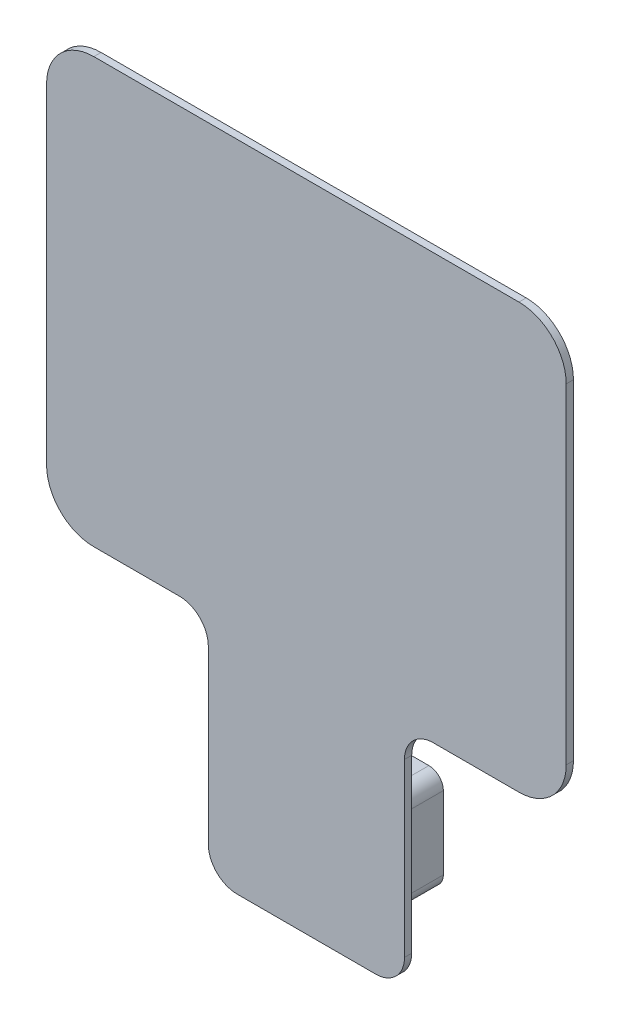
from build123d import *

# Parameters (mm, degrees)
BOSS_EXTRUDE1_DEPTH = 5
SKETCH2_R           = 9
CUT_EXTRUDE1_DEPTH  = 75
BOSS_EXTRUDE2_DEPTH = 15
SKETCH4_R           = 18.116170111
SKETCH4_R_2         = 11.683917043
CUT_EXTRUDE2_DEPTH  = 15
CUT_EXTRUDE2_TAPER  = 45
SKETCH5_W           = 100.933414707
SKETCH5_H           = 70.54527083
BOSS_EXTRUDE3_DEPTH = 40
FILLET1_R           = 10
SKETCH6_W           = 80.933414707
SKETCH6_H           = 50.54527083
CUT_EXTRUDE3_DEPTH  = 7
SKETCH7_R           = 6.405339055
CUT_EXTRUDE4_DEPTH  = 22


with BuildPart() as part:
    # Sketch1 → Boss-Extrude1 (new body)
    with BuildSketch(Plane.XY):
        with BuildLine():
            Line((-147.184574627, 293.941978101), (147.184574627, 293.941978101))
            ThreePointArc((147.184574627, 293.941978101), (170.33130349, 284.354289081), (179.91899251, 261.207560218))
            Line((179.91899251, 261.207560218), (179.91899251, 32.734417883))
            ThreePointArc((179.91899251, 32.734417883), (170.33130349, 9.58768902), (147.184574627, 0))
            Line((147.184574627, 0), (87.922065379, 0))
            ThreePointArc((87.922065379, 0), (73.779929755, -5.857864376), (67.922065379, -20))
            Line((67.922065379, -20), (67.922065379, -138.690071177))
            ThreePointArc((67.922065379, -138.690071177), (62.064201003, -152.832206801), (47.922065379, -158.690071177))
            Line((47.922065379, -158.690071177), (-47.922065379, -158.690071177))
            ThreePointArc((-47.922065379, -158.690071177), (-62.064201003, -152.832206801), (-67.922065379, -138.690071177))
            Line((-67.922065379, -138.690071177), (-67.922065379, -20))
            ThreePointArc((-67.922065379, -20), (-73.779929755, -5.857864376), (-87.922065379, 0))
            Line((-87.922065379, 0), (-147.184574627, 0))
            ThreePointArc((-147.184574627, 0), (-170.33130349, 9.58768902), (-179.91899251, 32.734417883))
            Line((-179.91899251, 32.734417883), (-179.91899251, 261.207560218))
            ThreePointArc((-179.91899251, 261.207560218), (-170.33130349, 284.354289081), (-147.184574627, 293.941978101))
        make_face()
    extrude(amount=BOSS_EXTRUDE1_DEPTH)

    # Sketch2 → Cut-Extrude1 (cut)
    with BuildSketch(Plane.XY.offset(5)):
        with Locations((-147.184574627, 261.207560218)):
            Circle(SKETCH2_R)
        with Locations((147.184574627, 261.207560218)):
            Circle(SKETCH2_R)
        with Locations((147.184574627, 32.734417883)):
            Circle(SKETCH2_R)
        with Locations((-147.184574627, 32.734417883)):
            Circle(SKETCH2_R)
    extrude(amount=-CUT_EXTRUDE1_DEPTH, mode=Mode.SUBTRACT)

    # Sketch3 → Boss-Extrude2 (add)
    with BuildSketch(Plane.XY.offset(5)):
        Polygon((139.58276715, 272.953720991), (133.211197263, 260.497282214), (140.81300474, 248.751121442), (154.786382105, 249.461399446), (161.157951992, 261.917838222), (153.556144514, 273.663998995), align=None)
        Polygon((-140.81300474, 273.663998995), (-154.786382105, 272.953720991), (-161.157951992, 260.497282214), (-153.556144514, 248.751121442), (-139.58276715, 249.461399446), (-133.211197263, 261.917838222), align=None)
        Polygon((139.58276715, 44.480578655), (133.211197263, 32.024139879), (140.81300474, 20.277979107), (154.786382105, 20.988257111), (161.157951992, 33.444695887), (153.556144514, 45.190856659), align=None)
        Polygon((-154.786382105, 44.480578655), (-161.157951992, 32.024139879), (-153.556144514, 20.277979107), (-139.58276715, 20.988257111), (-133.211197263, 33.444695887), (-140.81300474, 45.190856659), align=None)
    extrude(amount=-BOSS_EXTRUDE2_DEPTH)

    # Sketch4 → Cut-Extrude2 (cut)
    # profile 1 of 4: a face of its own
    with BuildSketch(Plane(origin=(0, 0, -10), x_dir=(-1, 0, 0), z_dir=(0, 0, -1))):
        with Locations((-147.184574627, 261.207560218)):
            Circle(SKETCH4_R)
        with Locations((-147.184574627, 261.207560218)):
            Circle(SKETCH4_R_2, mode=Mode.SUBTRACT)
    # profile 2 of 4: a face of its own
    with BuildSketch(Plane(origin=(0, 0, -10), x_dir=(-1, 0, 0), z_dir=(0, 0, -1))):
        with Locations((-147.184574627, 32.734417883)):
            Circle(SKETCH4_R)
        with Locations((-147.184574627, 32.734417883)):
            Circle(SKETCH4_R_2, mode=Mode.SUBTRACT)
    # profile 3 of 4: a face of its own
    with BuildSketch(Plane(origin=(0, 0, -10), x_dir=(-1, 0, 0), z_dir=(0, 0, -1))):
        with Locations((147.184574627, 32.734417883)):
            Circle(SKETCH4_R)
        with Locations((147.184574627, 32.734417883)):
            Circle(SKETCH4_R_2, mode=Mode.SUBTRACT)
    # profile 4 of 4: a face of its own
    with BuildSketch(Plane(origin=(0, 0, -10), x_dir=(-1, 0, 0), z_dir=(0, 0, -1))):
        with Locations((147.184574627, 261.207560218)):
            Circle(SKETCH4_R)
        with Locations((147.184574627, 261.207560218)):
            Circle(SKETCH4_R_2, mode=Mode.SUBTRACT)
    extrude(amount=-CUT_EXTRUDE2_DEPTH, taper=CUT_EXTRUDE2_TAPER, mode=Mode.SUBTRACT)

    # Sketch5 → Boss-Extrude3 (add)
    with BuildSketch(Plane(origin=(0, 0, 0), x_dir=(-1, 0, 0), z_dir=(0, 0, -1))):
        with Locations((0.645780789, -95.485224261)):
            Rectangle(SKETCH5_W, SKETCH5_H)
    extrude(amount=BOSS_EXTRUDE3_DEPTH)

    # Fillet1
    fillet1_edges = [part.edges().sort_by_distance(p)[0] for p in [
        (49.820926565, -60.212588846, -20),
        (49.820926565, -130.757859676, -20),
        (-51.112488142, -130.757859676, -20),
        (-51.112488142, -60.212588846, -20),
    ]]
    fillet(fillet1_edges, radius=FILLET1_R)

    # Sketch6 → Cut-Extrude3 (cut)
    with BuildSketch(Plane(origin=(0, 0, -40), x_dir=(-1, 0, 0), z_dir=(0, 0, -1))):
        with Locations((0.645780789, -95.485224261)):
            Rectangle(SKETCH6_W, SKETCH6_H)
    extrude(amount=-CUT_EXTRUDE3_DEPTH, mode=Mode.SUBTRACT)

    # Sketch7 → Cut-Extrude4 (cut)
    with BuildSketch(Plane(origin=(0, 0, -33), x_dir=(-1, 0, 0), z_dir=(0, 0, -1))):
        with Locations((-24.146994076, -82.382499347)):
            Circle(SKETCH7_R)
        with Locations((0.645780789, -82.382499347)):
            Circle(SKETCH7_R)
        with Locations((0.645780789, -103.378848644)):
            Circle(SKETCH7_R)
        with Locations((25.493027066, -82.382499347)):
            Circle(SKETCH7_R)
    extrude(amount=-CUT_EXTRUDE4_DEPTH, mode=Mode.SUBTRACT)


solid = part.part
